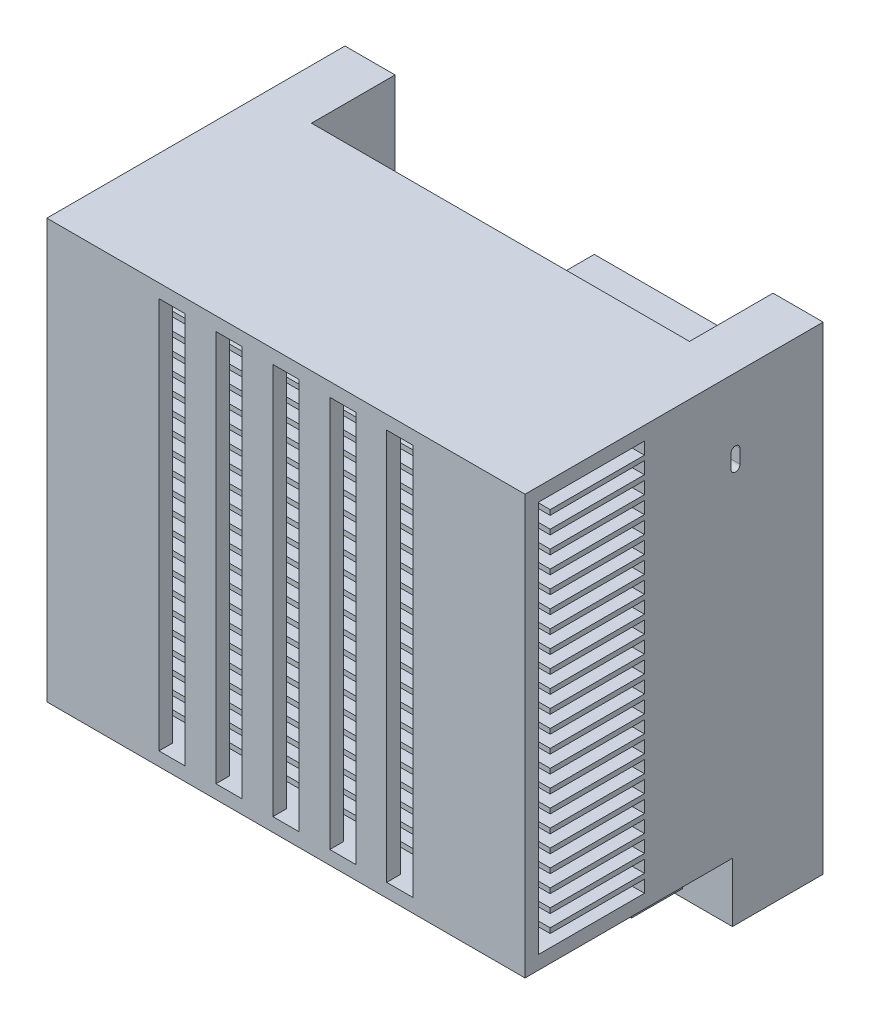
from build123d import *

# Parameters (mm, degrees)
ESQUISSE1_W             = 11
ESQUISSE1_H             = 105
ESQUISSE1_R             = 3.2
BOSS_EXTRU_1_DEPTH      = 18.35
BOSS_EXTRU_1_2_DEPTH    = 18.35
ESQUISSE2_W             = 105
ESQUISSE2_H             = 105
BOSS_EXTRU_2_DEPTH      = 1.57
ESQUISSE3_W             = 105
ESQUISSE3_H             = 92
BOSS_EXTRU_3_DEPTH      = 45.54
ESQUISSE4_W             = 89
ESQUISSE4_H             = 7.4
BOSS_EXTRU_4_DEPTH      = 11.16
ENL_V_MAT_EXTRU_1_REACH = 136.411
ENL_V_MAT_EXTRU_2_REACH = 100.982
ESQUISSE7_W             = 5.75
ESQUISSE7_H             = 86
ESQUISSE8_W             = 27
ESQUISSE8_H             = 8
BOSS_EXTRU_5_DEPTH      = 7.1
ESQUISSE9_R             = 2.75
ESQUISSE9_R_2           = 1.25
ENL_V_MAT_EXTRU_3_DEPTH = 10
ENL_V_START             = -10
ENL_V_MAT_EXTRU_4_DEPTH = 10


with BuildPart() as part:
    # Esquisse1 → Boss.-Extru.1 (new body)
    with BuildSketch(Plane.XY):
        with Locations((-47, 0)):
            Rectangle(ESQUISSE1_W, ESQUISSE1_H)
        with Locations((-46, 46)):
            Circle(ESQUISSE1_R, mode=Mode.SUBTRACT)
        with Locations((-46, -33)):
            Circle(ESQUISSE1_R, mode=Mode.SUBTRACT)
    extrude(amount=BOSS_EXTRU_1_DEPTH)



with BuildPart() as body_2:
    # Esquisse1 → Boss.-Extru.1 2 (new body)
    with BuildSketch(Plane.XY):
        with Locations((47, 0)):
            Rectangle(ESQUISSE1_W, ESQUISSE1_H)
        with Locations((46, 46)):
            Circle(ESQUISSE1_R, mode=Mode.SUBTRACT)
        with Locations((46, -33)):
            Circle(ESQUISSE1_R, mode=Mode.SUBTRACT)
    extrude(amount=BOSS_EXTRU_1_2_DEPTH)


with BuildPart() as part_1:
    add(part.part)

    add(body_2.part)  # Boss.-Extru.2 merges body 2
    # Esquisse2 → Boss.-Extru.2 (add)
    with BuildSketch(Plane.XY.offset(18.35)):
        Rectangle(ESQUISSE2_W, ESQUISSE2_H)
    extrude(amount=BOSS_EXTRU_2_DEPTH)

    # Esquisse3 → Boss.-Extru.3 (add)
    with BuildSketch(Plane.XY.offset(19.92)):
        with Locations((0, 6.5)):
            Rectangle(ESQUISSE3_W, ESQUISSE3_H)
    extrude(amount=BOSS_EXTRU_3_DEPTH)

    # Esquisse4 → Boss.-Extru.4 (add)
    with BuildSketch(Plane.XY.offset(19.92)):
        with Locations((-3, -47.1)):
            Rectangle(ESQUISSE4_W, ESQUISSE4_H)
    extrude(amount=BOSS_EXTRU_4_DEPTH)

    # Esquisse6 → Enlèv. mat.-Extru.1 (cut, up to next)
    with BuildSketch(Plane(origin=(52.5, 0, 0), x_dir=(0, 0, -1), z_dir=(1, 0, 0)), mode=Mode.PRIVATE) as enl_v_mat_extru_1_sk1:
        Polygon((-62.46, -36.5), (-62.46, 49.5), (-39.24, 49.5), (-39.24, 46.81), (-59.94, 46.81), (-59.94, 45.71), (-39.24, 45.78), (-39.24, 43.09), (-59.94, 43.09), (-59.94, 41.99), (-39.24, 41.99), (-39.24, 39.3), (-59.94, 39.3), (-59.94, 38.2), (-39.24, 38.2), (-39.24, 35.51), (-59.94, 35.51), (-59.94, 34.41), (-39.24, 34.41), (-39.24, 31.72), (-59.94, 31.72), (-59.94, 30.62), (-39.24, 30.62), (-39.24, 27.93), (-59.94, 27.93), (-59.94, 26.83), (-39.24, 26.83), (-39.24, 24.14), (-59.94, 24.14), (-59.94, 23.04), (-39.24, 23.04), (-39.24, 20.35), (-59.94, 20.35), (-59.94, 19.25), (-39.24, 19.25), (-39.24, 16.56), (-59.94, 16.56), (-59.94, 15.46), (-39.24, 15.46), (-39.24, 12.77), (-59.94, 12.77), (-59.94, 11.67), (-39.24, 11.67), (-39.24, 8.98), (-59.94, 8.98), (-59.94, 7.88), (-39.24, 7.88), (-39.24, 5.19), (-59.94, 5.19), (-59.94, 4.09), (-39.24, 4.09), (-39.24, 1.4), (-59.94, 1.4), (-59.94, 0.3), (-39.24, 0.3), (-39.24, -2.39), (-59.94, -2.39), (-59.94, -3.49), (-39.24, -3.49), (-39.24, -6.18), (-59.94, -6.18), (-59.94, -7.28), (-39.24, -7.28), (-39.24, -9.97), (-59.94, -9.97), (-59.94, -11.07), (-39.24, -11.07), (-39.24, -13.76), (-59.94, -13.76), (-59.94, -14.86), (-39.24, -14.86), (-39.24, -17.55), (-59.94, -17.55), (-59.94, -18.65), (-39.24, -18.65), (-39.24, -21.34), (-59.94, -21.34), (-59.94, -22.44), (-39.24, -22.44), (-39.24, -25.13), (-59.94, -25.13), (-59.94, -26.23), (-39.24, -26.23), (-39.24, -28.92), (-59.94, -28.92), (-59.94, -30.02), (-39.24, -30.02), (-39.24, -32.71), (-59.94, -32.71), (-59.94, -33.81), (-39.24, -33.81), (-39.24, -36.5), align=None)
    enl_v_mat_extru_1_tool1 = extrude(enl_v_mat_extru_1_sk1.sketch, amount=-ENL_V_MAT_EXTRU_1_REACH, mode=Mode.PRIVATE) & part_1.part
    add(enl_v_mat_extru_1_tool1.solids().sort_by_distance((52.5, 6.508342, 51.269436))[0], mode=Mode.SUBTRACT)

    # Esquisse7 → Enlèv. mat.-Extru.2 (cut, up to next)
    with BuildSketch(Plane.XY.offset(65.46), mode=Mode.PRIVATE) as enl_v_mat_extru_2_sk1:
        with Locations((0.005, 6.5)):
            Rectangle(ESQUISSE7_W, ESQUISSE7_H)
    enl_v_mat_extru_2_tool1 = extrude(enl_v_mat_extru_2_sk1.sketch, amount=-ENL_V_MAT_EXTRU_2_REACH, mode=Mode.PRIVATE) & part_1.part
    # Esquisse7 → Enlèv. mat.-Extru.2 (cut, up to next)
    with BuildSketch(Plane.XY.offset(65.46), mode=Mode.PRIVATE) as enl_v_mat_extru_2_sk2:
        with Locations((-12.495, 6.5)):
            Rectangle(ESQUISSE7_W, ESQUISSE7_H)
    enl_v_mat_extru_2_tool2 = extrude(enl_v_mat_extru_2_sk2.sketch, amount=-ENL_V_MAT_EXTRU_2_REACH, mode=Mode.PRIVATE) & part_1.part
    # Esquisse7 → Enlèv. mat.-Extru.2 (cut, up to next)
    with BuildSketch(Plane.XY.offset(65.46), mode=Mode.PRIVATE) as enl_v_mat_extru_2_sk3:
        with Locations((-24.995, 6.5)):
            Rectangle(ESQUISSE7_W, ESQUISSE7_H)
    enl_v_mat_extru_2_tool3 = extrude(enl_v_mat_extru_2_sk3.sketch, amount=-ENL_V_MAT_EXTRU_2_REACH, mode=Mode.PRIVATE) & part_1.part
    # Esquisse7 → Enlèv. mat.-Extru.2 (cut, up to next)
    with BuildSketch(Plane.XY.offset(65.46), mode=Mode.PRIVATE) as enl_v_mat_extru_2_sk4:
        with Locations((25.005, 6.5)):
            Rectangle(ESQUISSE7_W, ESQUISSE7_H)
    enl_v_mat_extru_2_tool4 = extrude(enl_v_mat_extru_2_sk4.sketch, amount=-ENL_V_MAT_EXTRU_2_REACH, mode=Mode.PRIVATE) & part_1.part
    # Esquisse7 → Enlèv. mat.-Extru.2 (cut, up to next)
    with BuildSketch(Plane.XY.offset(65.46), mode=Mode.PRIVATE) as enl_v_mat_extru_2_sk5:
        with Locations((12.505, 6.5)):
            Rectangle(ESQUISSE7_W, ESQUISSE7_H)
    enl_v_mat_extru_2_tool5 = extrude(enl_v_mat_extru_2_sk5.sketch, amount=-ENL_V_MAT_EXTRU_2_REACH, mode=Mode.PRIVATE) & part_1.part
    add(enl_v_mat_extru_2_tool1.solids().sort_by_distance((0.005, 6.5, 65.46))[0], mode=Mode.SUBTRACT)
    add(enl_v_mat_extru_2_tool2.solids().sort_by_distance((-12.495, 6.5, 65.46))[0], mode=Mode.SUBTRACT)
    add(enl_v_mat_extru_2_tool3.solids().sort_by_distance((-24.995, 6.5, 65.46))[0], mode=Mode.SUBTRACT)
    add(enl_v_mat_extru_2_tool4.solids().sort_by_distance((25.005, 6.5, 65.46))[0], mode=Mode.SUBTRACT)
    add(enl_v_mat_extru_2_tool5.solids().sort_by_distance((12.505, 6.5, 65.46))[0], mode=Mode.SUBTRACT)

    # Esquisse8 → Boss.-Extru.5 (add)
    with BuildSketch(Plane(origin=(0, 0, 18.35), x_dir=(-1, 0, 0), z_dir=(0, 0, -1))):
        with Locations((-27, 47.5)):
            Rectangle(ESQUISSE8_W, ESQUISSE8_H)
    extrude(amount=BOSS_EXTRU_5_DEPTH)

    # Esquisse9 → Enlèv. mat.-Extru.3 (cut)
    # profile 1 of 4: a face of its own
    with BuildSketch(Plane.ZY.offset(52.5)):
        with Locations((13.25, 36.1)):
            Circle(ESQUISSE9_R)
        with Locations((13.25, 36.1)):
            Circle(ESQUISSE9_R_2, mode=Mode.SUBTRACT)
    # profile 2 of 4: a face of its own
    with BuildSketch(Plane.ZY.offset(52.5)):
        Polygon((18.85, 26.5), (18.85, 22.626049106), (20.53, 22.626049106), (20.53, 18.373950894), (18.85, 18.373950894), (18.85, 14.5), (12, 14.5), (12, 26.5), align=None)
    # profile 3 of 4: a face of its own
    with BuildSketch(Plane.ZY.offset(52.5)):
        with BuildLine():
            Line((20.25, 37.6), (20.25, 34.6))
            ThreePointArc((20.25, 34.6), (19.25, 33.6), (18.25, 34.6))
            Line((18.25, 34.6), (18.25, 37.6))
            ThreePointArc((18.25, 37.6), (19.25, 38.6), (20.25, 37.6))
        make_face()
    # profile 4 of 4: a face of its own
    with BuildSketch(Plane.ZY.offset(52.5)):
        Polygon((18.85, -13.5), (18.85, -27.5), (16.85, -27.5), (16.85, -26.5), (14.85, -23), (14.85, -18), (16.85, -14.5), (16.85, -13.5), align=None)
    extrude(amount=-ENL_V_MAT_EXTRU_3_DEPTH, mode=Mode.SUBTRACT)

    # Esquisse10 → Enlèv. mat.-Extru.4 (cut)
    with BuildSketch(Plane(origin=(52.5, 0, 0), x_dir=(0, 0, -1), z_dir=(1, 0, 0)).offset(ENL_V_START)):
        with BuildLine():
            Line((-20.25, 34.6), (-20.25, 37.6))
            ThreePointArc((-20.25, 37.6), (-19.25, 38.6), (-18.25, 37.6))
            Line((-18.25, 37.6), (-18.25, 34.6))
            ThreePointArc((-18.25, 34.6), (-19.25, 33.6), (-20.25, 34.6))
        make_face()
    extrude(amount=ENL_V_MAT_EXTRU_4_DEPTH, mode=Mode.SUBTRACT)


solid = part_1.part
